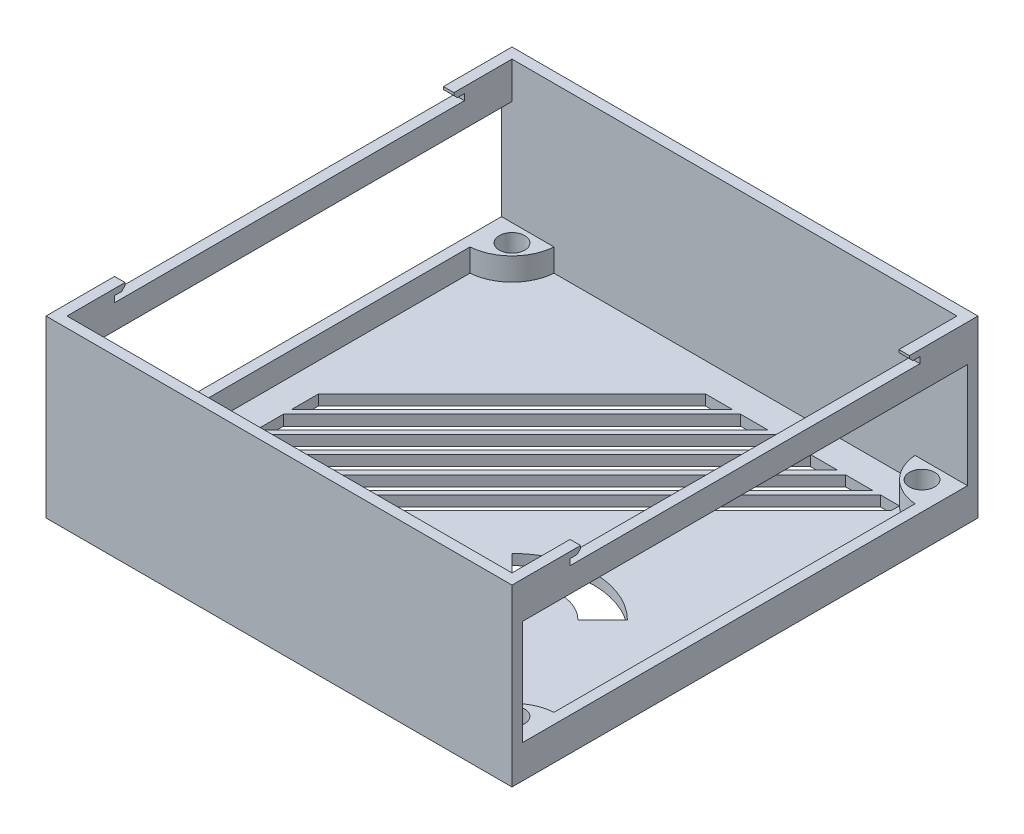
from build123d import *

# Parameters (mm, degrees)
SKETCH1_W                = 133.2
SKETCH1_H                = 133.2
SKETCH1_W_2              = 127.2
SKETCH1_H_2              = 127.2
BOSS_EXTRUDE1_DEPTH      = 50
SKETCH2_W                = 127.2
SKETCH2_H                = 127.2
BOSS_EXTRUDE2_DEPTH      = 3
BOSS_EXTRUDE4_DEPTH      = 7
BOSS_EXTRUDE4_DEPTH_BACK = 3
SKETCH3_R                = 3.625
SKETCH4_W                = 127.2
SKETCH4_H                = 30
CUT_EXTRUDE2_DEPTH       = 158.091692969
CUT_EXTRUDE3_DEPTH       = 158.091692969
CUT_EXTRUDE6_DEPTH       = 106.262148943


with BuildPart() as part:
    # Sketch1 → Boss-Extrude1 (new body)
    with BuildSketch(Plane(origin=(0, 0, 0), x_dir=(1, 0, 0), z_dir=(0, 1, 0))):
        Rectangle(SKETCH1_W, SKETCH1_H)
        Rectangle(SKETCH1_W_2, SKETCH1_H_2, mode=Mode.SUBTRACT)
    extrude(amount=BOSS_EXTRUDE1_DEPTH)

    # Sketch2 → Boss-Extrude2 (add)
    with BuildSketch(Plane(origin=(0, 0, 0), x_dir=(1, 0, 0), z_dir=(0, 1, 0))):
        Rectangle(SKETCH2_W, SKETCH2_H)
    extrude(amount=BOSS_EXTRUDE2_DEPTH)

    # Sketch3 → Boss-Extrude4 (add, two sides: drawn at the far end of the back side and taken through both)
    # profile 1 of 4: a face of its own
    with BuildSketch(Plane(origin=(0, 3, 0), x_dir=(1, 0, 0), z_dir=(0, 1, 0)).offset(-BOSS_EXTRUDE4_DEPTH_BACK)):
        with BuildLine():
            ThreePointArc((-63.6, 51.6), (-55.371805983, 55.371805983), (-51.6, 63.6))
            Line((-51.6, 63.6), (-63.6, 63.6))
            Line((-63.6, 63.6), (-63.6, 51.6))
        make_face()
        with Locations(Location((-58.6, 58.6, 0), (0, 0, 270))):
            Circle(SKETCH3_R, mode=Mode.SUBTRACT)
    # profile 2 of 4: a face of its own
    with BuildSketch(Plane(origin=(0, 3, 0), x_dir=(1, 0, 0), z_dir=(0, 1, 0)).offset(-BOSS_EXTRUDE4_DEPTH_BACK)):
        with BuildLine():
            ThreePointArc((-51.902705138, -63.6), (-55.559775075, -55.463705987), (-63.6, -51.6))
            Line((-63.6, -51.6), (-63.6, -63.6))
            Line((-63.6, -63.6), (-51.902705138, -63.6))
        make_face()
        with Locations(Location((-58.6, -58.6, 0), (0, 0, 90))):
            Circle(SKETCH3_R, mode=Mode.SUBTRACT)
    # profile 3 of 4: a face of its own
    with BuildSketch(Plane(origin=(0, 3, 0), x_dir=(1, 0, 0), z_dir=(0, 1, 0)).offset(-BOSS_EXTRUDE4_DEPTH_BACK)):
        with BuildLine():
            Line((63.6, 63.6), (51.6, 63.6))
            ThreePointArc((51.6, 63.6), (55.375031477, 55.378323531), (63.6, 51.610470108))
            Line((63.6, 51.610470108), (63.6, 63.6))
        make_face()
        with Locations(Location((58.6, 58.6, 0), (0, 0, 90))):
            Circle(SKETCH3_R, mode=Mode.SUBTRACT)
    # profile 4 of 4: a face of its own
    with BuildSketch(Plane(origin=(0, 3, 0), x_dir=(1, 0, 0), z_dir=(0, 1, 0)).offset(-BOSS_EXTRUDE4_DEPTH_BACK)):
        with BuildLine():
            Line((63.6, -63.6), (63.6, -51.6))
            ThreePointArc((63.6, -51.6), (55.371805983, -55.371805983), (51.6, -63.6))
            Line((51.6, -63.6), (63.6, -63.6))
        make_face()
        with Locations(Location((58.6, -58.6, 0), (0, 0, 270))):
            Circle(SKETCH3_R, mode=Mode.SUBTRACT)
    extrude(amount=BOSS_EXTRUDE4_DEPTH + BOSS_EXTRUDE4_DEPTH_BACK)

    # Sketch4 → Cut-Extrude2 (cut, through all)
    with BuildSketch(Plane(origin=(66.6, 0, 0), x_dir=(0, 0, -1), z_dir=(1, 0, 0))):
        with Locations((0, 24.5)):
            Rectangle(SKETCH4_W, SKETCH4_H)
    extrude(amount=-CUT_EXTRUDE2_DEPTH, mode=Mode.SUBTRACT)

    # Sketch5 → Cut-Extrude3 (cut, through all)
    with BuildSketch(Plane(origin=(66.6, 0, 0), x_dir=(0, 0, -1), z_dir=(1, 0, 0))):
        Polygon((-50, 48.25), (-50, 46.5), (50, 46.5), (50, 48.25), (48, 48.25), (47, 49.25), (47, 50), (-47, 50), (-47, 49.25), (-48, 48.25), align=None)
    extrude(amount=-CUT_EXTRUDE3_DEPTH, mode=Mode.SUBTRACT)

    # Sketch6 → Cut-Extrude6 (cut, through all)
    with BuildSketch(Plane(origin=(0, 3, 0), x_dir=(1, 0, 0), z_dir=(0, 1, 0))):
        Polygon((-53.053423166, -55.371805983), (-55.371805983, -55.371805983), (-55.371805983, -50), (-5.371805983, 0), (50, 55.371805983), (55.371805983, 55.371805983), (55.371805983, 53.053423166), (53.8450944, 51.526711583), (-1.526711583, -3.8450944), (-5.371805983, -7.690188801), align=None)
        Polygon((-55.371805983, -37.690188801), (-55.371805983, -30), (-25.371805983, 0), (30, 55.371805983), (37.690188801, 55.371805983), (33.8450944, 51.526711583), (-21.526711583, -3.8450944), (-25.371805983, -7.690188801), align=None)
        Polygon((-55.371805983, -27.690188801), (-55.371805983, -20), (-35.371805983, 0), (20, 55.371805983), (27.690188801, 55.371805983), (23.8450944, 51.526711583), (-31.526711583, -3.8450944), (-35.371805983, -7.690188801), align=None)
        Polygon((-55.371805983, -17.690188801), (-55.371805983, -10), (-45.371805983, 0), (10, 55.371805983), (17.690188801, 55.371805983), (13.8450944, 51.526711583), (-41.526711583, -3.8450944), (-45.371805983, -7.690188801), align=None)
        Polygon((0, 55.371805983), (7.690188801, 55.371805983), (3.8450944, 51.526711583), (-51.526711583, -3.8450944), (-55.371805983, -7.690188801), (-55.371805983, 0), align=None)
        with BuildLine():
            ThreePointArc((18.836860938, -37.694136454), (28.265498696, -41.599606087), (37.694136454, -37.694136454))
            Line((37.694136454, -37.694136454), (28.265498696, -28.265498696))
            Line((28.265498696, -28.265498696), (18.836860938, -37.694136454))
        make_face()
        with BuildLine():
            Line((41.229670359, -15.301327032), (44.765204265, -11.765793127))
            ThreePointArc((44.765204265, -11.765793127), (28.265498696, -4.931391304), (11.765793127, -11.765793127))
            Line((11.765793127, -11.765793127), (15.301327032, -15.301327032))
            Line((15.301327032, -15.301327032), (18.836860938, -18.836860938))
            ThreePointArc((18.836860938, -18.836860938), (28.265498696, -14.931391304), (37.694136454, -18.836860938))
            Line((37.694136454, -18.836860938), (41.229670359, -15.301327032))
        make_face()
        Polygon((-15.371805983, 0), (-55.371805983, -40), (-55.371805983, -47.690188801), (-15.371805983, -7.690188801), (-11.526711583, -3.8450944), (43.8450944, 51.526711583), (47.690188801, 55.371805983), (40, 55.371805983), align=None)
    extrude(amount=-CUT_EXTRUDE6_DEPTH, mode=Mode.SUBTRACT)


solid = part.part
